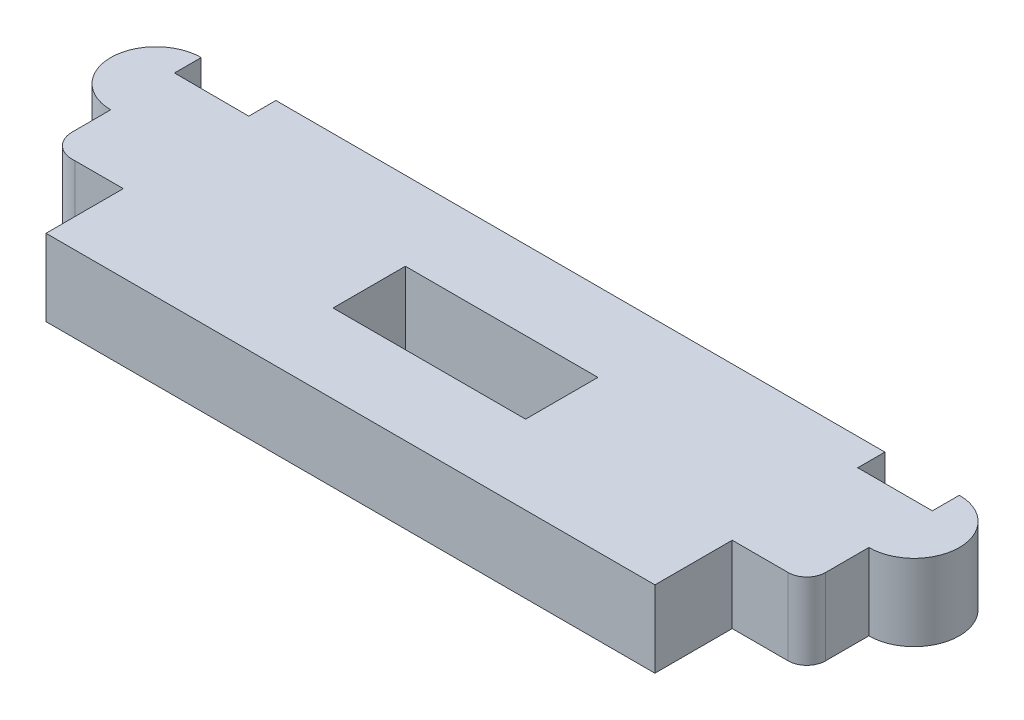
from build123d import *

# Parameters (mm, degrees)
SKETCH2_W           = 7.98583157
SKETCH2_H           = 3.000090293
BOSS_EXTRUDE1_DEPTH = 3.175


with BuildPart() as part:
    # Sketch2 → Boss-Extrude1 (new body)
    with BuildSketch(Plane(origin=(0, 0, 0), x_dir=(1, 0, 0), z_dir=(0, 1, 0))):
        with BuildLine():
            Line((12.625998491, -1.744524944), (12.625998491, -4.950391186))
            Line((12.625998491, -4.950391186), (-12.629130241, -4.950391186))
            Line((-12.629130241, -4.950391186), (-12.629130241, -1.744524944))
            Line((-12.629130241, -1.744524944), (-14.623097356, -1.744524944))
            ThreePointArc((-14.623097356, -1.744524944), (-15.39182083, -1.504361603), (-15.722173536, -0.769867695))
            Line((-15.722173536, -0.769867695), (-15.722173536, 0.826844293))
            ThreePointArc((-15.722173536, 0.826844293), (-17.599363905, 2.704034662), (-15.722173536, 4.581225032))
            Line((-15.722173536, 4.581225032), (-15.722173536, 3.471753772))
            Line((-15.722173536, 3.471753772), (-12.631299313, 3.460874113))
            Line((-12.631299313, 3.460874113), (-12.631299313, 4.586967616))
            Line((-12.631299313, 4.586967616), (12.625998491, 4.586967616))
            Line((12.625998491, 4.586967616), (12.625998491, 3.460874113))
            Line((12.625998491, 3.460874113), (15.720511393, 3.460874113))
            Line((15.720511393, 3.460874113), (15.720511393, 4.581225031))
            ThreePointArc((15.720511393, 4.581225031), (17.597858023, 2.703878401), (15.720511393, 0.826531771))
            Line((15.720511393, 0.826531771), (15.720511393, -0.972713755))
            ThreePointArc((15.720511393, -0.972713755), (15.488390746, -1.524540285), (14.931614971, -1.744524944))
            Line((14.931614971, -1.744524944), (12.625998491, -1.744524944))
        make_face()
        with Locations((2.437e-06, -0.181702019)):
            Rectangle(SKETCH2_W, SKETCH2_H, mode=Mode.SUBTRACT)
    extrude(amount=BOSS_EXTRUDE1_DEPTH)


solid = part.part
